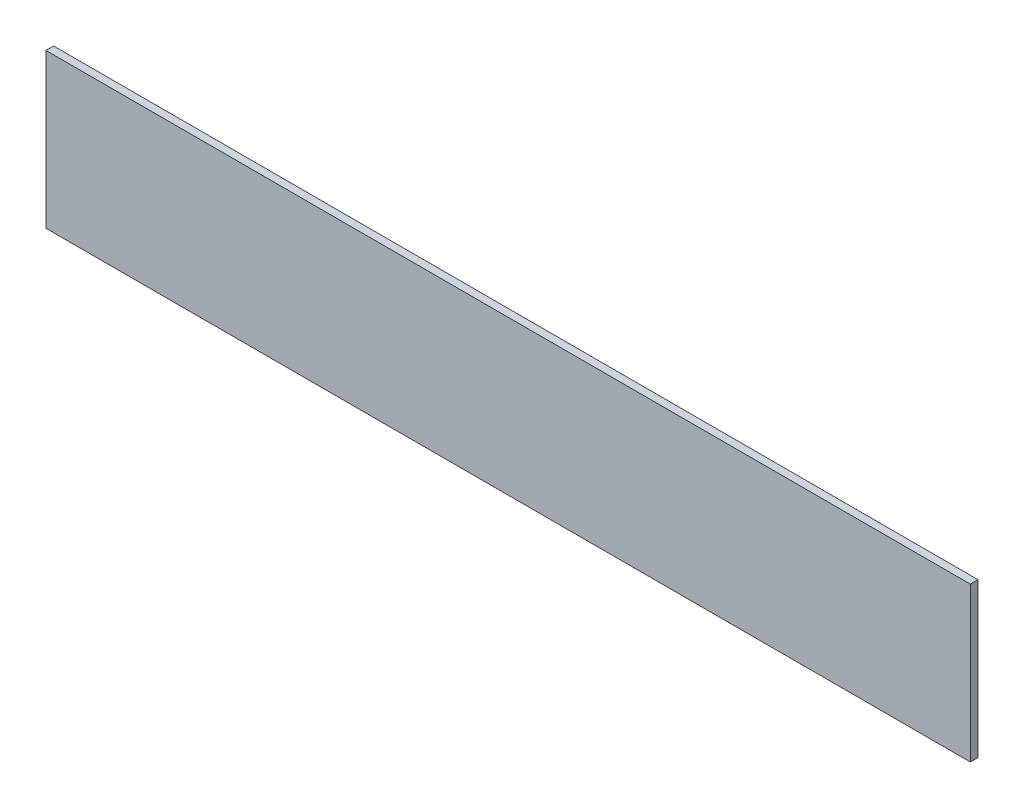
from build123d import *

# Parameters (mm, degrees)
ESQUISSE1_W        = 1200
ESQUISSE1_H        = 200
BOSS_EXTRU_1_DEPTH = 10


with BuildPart() as part:
    # Esquisse1 → Boss.-Extru.1 (new body)
    with BuildSketch(Plane.XY):
        with Locations((600, -100)):
            Rectangle(ESQUISSE1_W, ESQUISSE1_H)
    extrude(amount=BOSS_EXTRU_1_DEPTH)


solid = part.part
